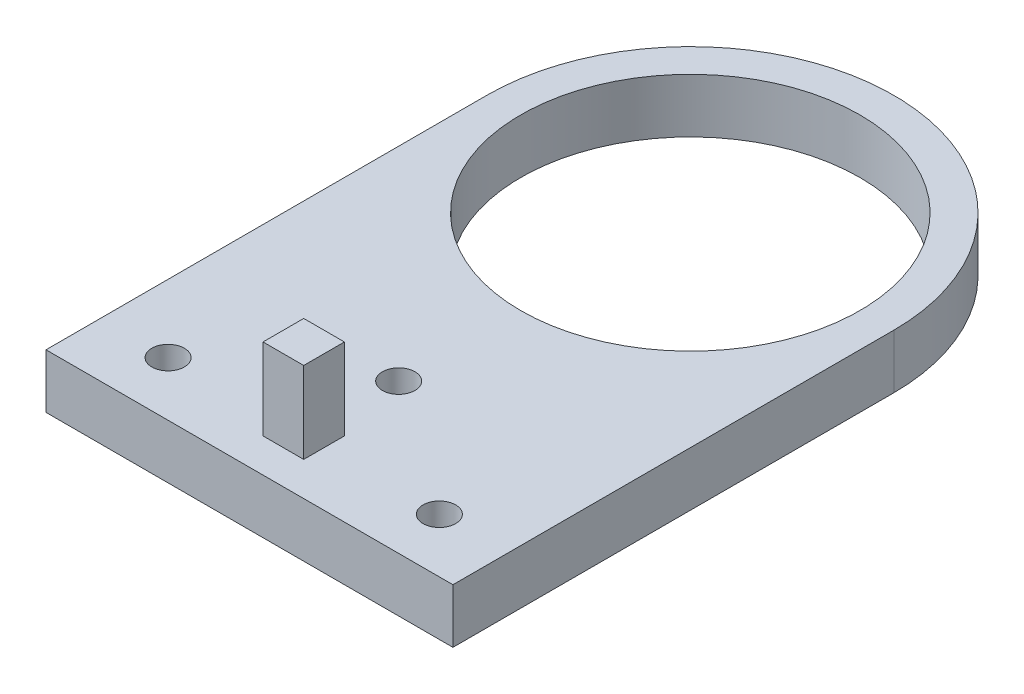
from build123d import *

# Parameters (mm, degrees)
BOSS_EXTRUDE1_DEPTH                                 = 4
CUT_EXTRUDE1_REACH                                  = 51.972
SKETCH2_R                                           = 12.5
SKETCH3_W                                           = 3
SKETCH3_H                                           = 3
BOSS_EXTRUDE2_DEPTH                                 = 6
CSK_FOR_M2_COUNTERSUNK_FLAT_HEAD_SCREW1_D           = 2.4
CSK_FOR_M2_COUNTERSUNK_FLAT_HEAD_SCREW1_DEPTH       = 5.2
CSK_FOR_M2_COUNTERSUNK_FLAT_HEAD_SCREW1_CSINK_D     = 5.4
CSK_FOR_M2_COUNTERSUNK_FLAT_HEAD_SCREW1_CSINK_ANGLE = 90
CSK_FOR_M2_COUNTERSUNK_FLAT_HEAD_SCREW1_TIP         = 0.721032743


with BuildPart() as part:
    # Sketch1 → Boss-Extrude1 (new body)
    with BuildSketch(Plane(origin=(0, 0, 0), x_dir=(1, 0, 0), z_dir=(0, 1, 0))):
        with BuildLine():
            Line((-15, 0), (15, 0))
            Line((15, 0), (15, 32.5))
            ThreePointArc((15, 32.5), (0, 47.5), (-15, 32.5))
            Line((-15, 32.5), (-15, 0))
        make_face()
    extrude(amount=BOSS_EXTRUDE1_DEPTH)

    # Sketch2 → Cut-Extrude1 (cut, up to next)
    with BuildSketch(Plane(origin=(0, 4, 0), x_dir=(1, 0, 0), z_dir=(0, 1, 0)), mode=Mode.PRIVATE) as cut_extrude1_sk1:
        with Locations(Location((0, 32.5, 0), (0, 0, 270))):
            Circle(SKETCH2_R)
    cut_extrude1_tool1 = extrude(cut_extrude1_sk1.sketch, amount=-CUT_EXTRUDE1_REACH, mode=Mode.PRIVATE) & part.part
    add(cut_extrude1_tool1.solids().sort_by_distance((0, 4, -32.5))[0], mode=Mode.SUBTRACT)

    # Sketch3 → Boss-Extrude2 (add)
    with BuildSketch(Plane(origin=(0, 4, 0), x_dir=(1, 0, 0), z_dir=(0, 1, 0))):
        with Locations((0, 4)):
            Rectangle(SKETCH3_W, SKETCH3_H)
    extrude(amount=BOSS_EXTRUDE2_DEPTH)

    # CSK for M2 Countersunk Flat Head Screw1
    with Locations(Plane(origin=(0, 0, 0), x_dir=(-1, 0, 0), z_dir=(0, -1, 0))):
        with Locations((-10, 4), (10, 4), (0, 11)):
            CounterSinkHole(CSK_FOR_M2_COUNTERSUNK_FLAT_HEAD_SCREW1_D / 2, CSK_FOR_M2_COUNTERSUNK_FLAT_HEAD_SCREW1_CSINK_D / 2, depth=CSK_FOR_M2_COUNTERSUNK_FLAT_HEAD_SCREW1_DEPTH, counter_sink_angle=CSK_FOR_M2_COUNTERSUNK_FLAT_HEAD_SCREW1_CSINK_ANGLE)
            with Locations((0, 0, -(CSK_FOR_M2_COUNTERSUNK_FLAT_HEAD_SCREW1_DEPTH + CSK_FOR_M2_COUNTERSUNK_FLAT_HEAD_SCREW1_TIP / 2))):  # 118° drill point
                Cone(0, CSK_FOR_M2_COUNTERSUNK_FLAT_HEAD_SCREW1_D / 2, CSK_FOR_M2_COUNTERSUNK_FLAT_HEAD_SCREW1_TIP, mode=Mode.SUBTRACT)


solid = part.part
